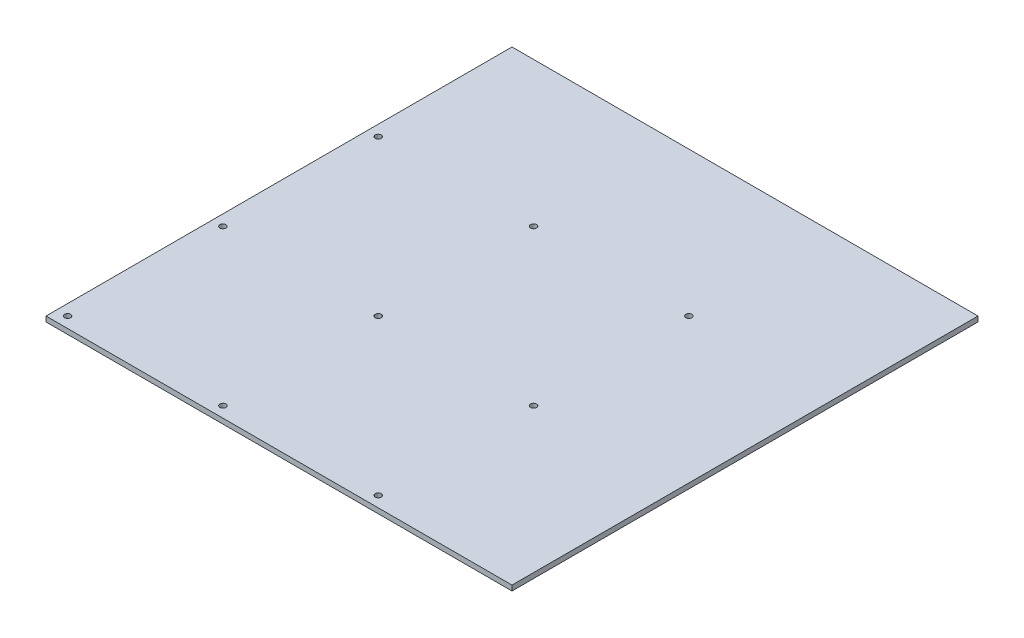
from build123d import *

# Parameters (mm, degrees)
SKETCH1_W           = 540
SKETCH1_H           = 540
SKETCH1_R           = 3.5
BOSS_EXTRUDE1_DEPTH = 6


with BuildPart() as part:
    # Sketch1 → Boss-Extrude1 (new body)
    with BuildSketch(Plane(origin=(0, 0, 0), x_dir=(1, 0, 0), z_dir=(0, 1, 0))):
        Rectangle(SKETCH1_W, SKETCH1_H)
        with Locations(Location((-257.5, -257.5, 0), (0, 0, 270))):
            Circle(SKETCH1_R, mode=Mode.SUBTRACT)
        with Locations(Location((-77.5, -257.5, 0), (0, 0, 270))):
            Circle(SKETCH1_R, mode=Mode.SUBTRACT)
        with Locations(Location((102.5, -257.5, 0), (0, 0, 270))):
            Circle(SKETCH1_R, mode=Mode.SUBTRACT)
        with Locations(Location((-77.5, -77.5, 0), (0, 0, 270))):
            Circle(SKETCH1_R, mode=Mode.SUBTRACT)
        with Locations(Location((102.5, -77.5, 0), (0, 0, 270))):
            Circle(SKETCH1_R, mode=Mode.SUBTRACT)
        with Locations(Location((-77.5, 102.5, 0), (0, 0, 270))):
            Circle(SKETCH1_R, mode=Mode.SUBTRACT)
        with Locations(Location((102.5, 102.5, 0), (0, 0, 270))):
            Circle(SKETCH1_R, mode=Mode.SUBTRACT)
        with Locations(Location((-257.5, -77.5, 0), (0, 0, 270))):
            Circle(SKETCH1_R, mode=Mode.SUBTRACT)
        with Locations(Location((-257.5, 102.5, 0), (0, 0, 270))):
            Circle(SKETCH1_R, mode=Mode.SUBTRACT)
    extrude(amount=BOSS_EXTRUDE1_DEPTH)


solid = part.part
